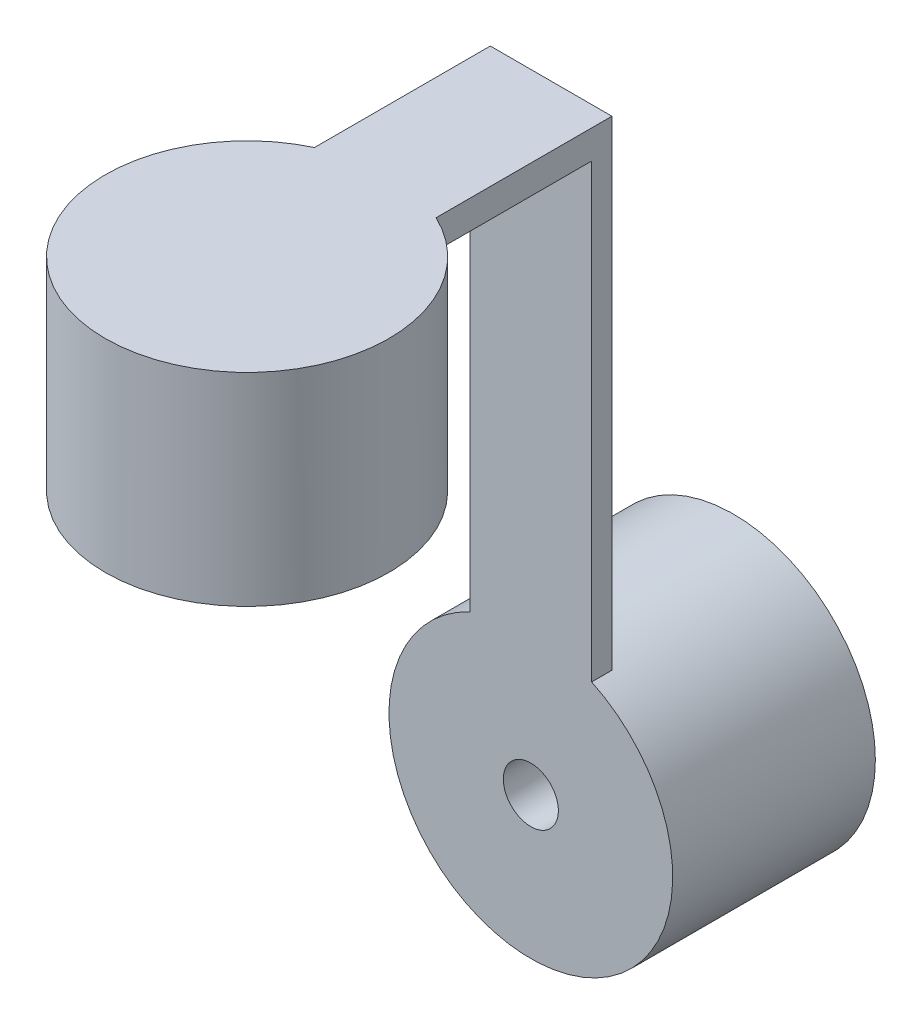
from build123d import *

# Parameters (mm, degrees)
SKETCH1_R           = 35
BOSS_EXTRUDE1_DEPTH = 50
SKETCH2_W           = 30
SKETCH2_H           = 5
BOSS_EXTRUDE2_DEPTH = 150
SKETCH3_W           = 30
SKETCH3_H           = 7.079136618
BOSS_EXTRUDE3_DEPTH = 70
SKETCH5_R           = 35
BOSS_EXTRUDE4_DEPTH = 50
SKETCH6_R           = 6.791338944
CUT_EXTRUDE1_DEPTH  = 50
SKETCH7_R           = 5
CUT_EXTRUDE2_DEPTH  = 10


with BuildPart() as part:
    # Sketch1 → Boss-Extrude1 (new body)
    with BuildSketch(Plane.XY):
        Circle(SKETCH1_R)
    extrude(amount=BOSS_EXTRUDE1_DEPTH)

    # Sketch2 → Boss-Extrude2 (add)
    with BuildSketch(Plane(origin=(0, 0, 0), x_dir=(1, 0, 0), z_dir=(0, 1, 0))):
        with Locations((0, -47.5)):
            Rectangle(SKETCH2_W, SKETCH2_H)
    extrude(amount=BOSS_EXTRUDE2_DEPTH)

    # Sketch3 → Boss-Extrude3 (add)
    with BuildSketch(Plane.XY.offset(50)):
        with Locations((0, 146.460431691)):
            Rectangle(SKETCH3_W, SKETCH3_H)
    extrude(amount=BOSS_EXTRUDE3_DEPTH)

    # Sketch5 → Boss-Extrude4 (add)
    with BuildSketch(Plane(origin=(0, 150, 0), x_dir=(1, 0, 0), z_dir=(0, 1, 0))):
        with Locations(Location((0, -120, 0), (0, 0, 270))):
            Circle(SKETCH5_R)
    extrude(amount=-BOSS_EXTRUDE4_DEPTH)

    # Sketch6 → Cut-Extrude1 (cut)
    with BuildSketch(Plane(origin=(0, 0, 0), x_dir=(-1, 0, 0), z_dir=(0, 0, -1))):
        Circle(SKETCH6_R)
    extrude(amount=-CUT_EXTRUDE1_DEPTH, mode=Mode.SUBTRACT)

    # Sketch7 → Cut-Extrude2 (cut)
    with BuildSketch(Plane.XZ.offset(-100)):
        with Locations(Location((0, 120, 0), (0, 0, 270))):
            Circle(SKETCH7_R)
    extrude(amount=-CUT_EXTRUDE2_DEPTH, mode=Mode.SUBTRACT)


solid = part.part
